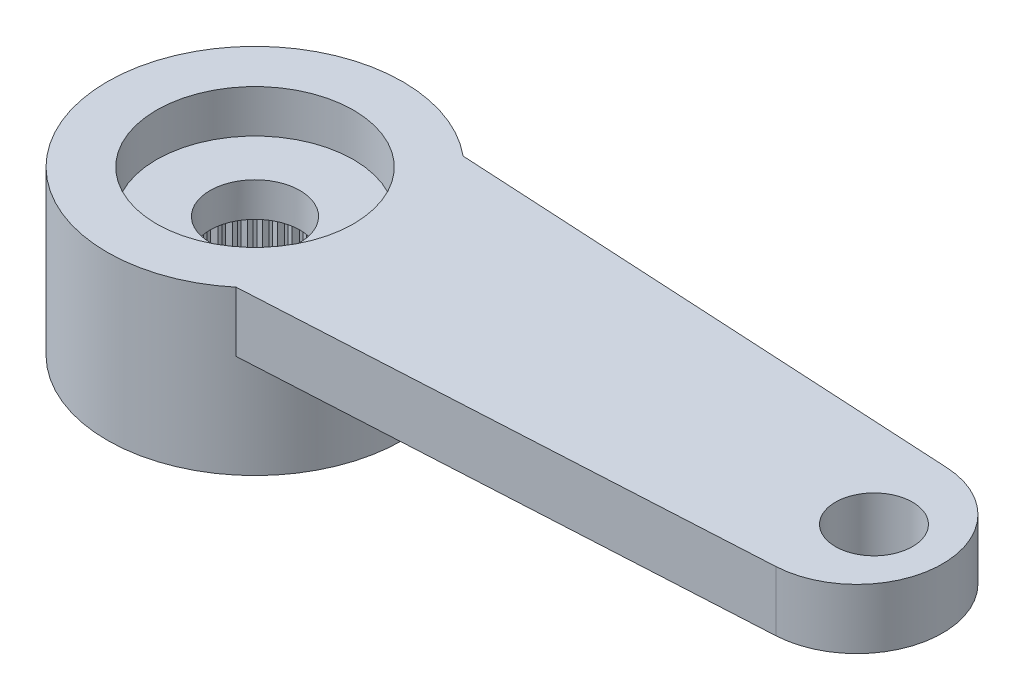
from build123d import *

# Parameters (mm, degrees)
BOSS_EXTRUDE1_DEPTH = 1.4
SKETCH2_R           = 3.45
BOSS_EXTRUDE2_DEPTH = 2.4
CUT_EXTRUDE1_DEPTH  = 2
HOLE1_D             = 2.1
HOLE1_DEPTH         = 3.8
HOLE1_CBORE_D       = 4.6
HOLE1_CBORE_DEPTH   = 1
CUT_EXTRUDE2_DEPTH  = 10
SKETCH7_R           = 0.9
CUT_EXTRUDE3_DEPTH  = 10


with BuildPart() as part:
    # Sketch1 → Boss-Extrude1 (new body)
    with BuildSketch(Plane(origin=(0, 0, 0), x_dir=(1, 0, 0), z_dir=(0, 1, 0))):
        with BuildLine():
            Line((2.209072, -2.65), (14.159122, -1.997021))
            ThreePointArc((14.159122, -1.997021), (16.05, 0), (14.159122, 1.997021))
            Line((14.159122, 1.997021), (2.209072, 2.65))
            ThreePointArc((2.209072, 2.65), (0, 3.45), (-2.209072, 2.65))
            Line((-2.209072, 2.65), (-14.159122, 1.997021))
            ThreePointArc((-14.159122, 1.997021), (-16.05, 0), (-14.159122, -1.997021))
            Line((-14.159122, -1.997021), (-2.209072, -2.65))
            ThreePointArc((-2.209072, -2.65), (0, -3.45), (2.209072, -2.65))
        make_face()
    extrude(amount=-BOSS_EXTRUDE1_DEPTH)

    # Sketch2 → Boss-Extrude2 (add)
    with BuildSketch(Plane.XZ.offset(1.4)):
        with Locations(Location((0, 0, 0), (0, 0, 129.814998))):
            Circle(SKETCH2_R)
    extrude(amount=BOSS_EXTRUDE2_DEPTH)

    # Sketch3 → Cut-Extrude1 (cut)
    with BuildSketch(Plane.XZ.offset(3.8)):
        with BuildLine():
            Line((-0.160985, 2.469759), (-0.248255, 2.36199))
            Line((-0.248255, 2.36199), (-0.356024, 2.449259))
            ThreePointArc((-0.356024, 2.449259), (-0.387175, 2.444529), (-0.418263, 2.439402))
            Line((-0.418263, 2.439402), (-0.49379, 2.323101))
            Line((-0.49379, 2.323101), (-0.610091, 2.398627))
            ThreePointArc((-0.610091, 2.398627), (-0.640577, 2.390666), (-0.670959, 2.382318))
            Line((-0.670959, 2.382318), (-0.733915, 2.258759))
            Line((-0.733915, 2.258759), (-0.857474, 2.321716))
            ThreePointArc((-0.857474, 2.321716), (-0.886961, 2.310612), (-0.916303, 2.299133))
            Line((-0.916303, 2.299133), (-0.966, 2.16967))
            Line((-0.966, 2.16967), (-1.095462, 2.219367))
            ThreePointArc((-1.095462, 2.219367), (-1.123626, 2.205241), (-1.151609, 2.190758))
            Line((-1.151609, 2.190758), (-1.1875, 2.05681))
            Line((-1.1875, 2.05681), (-1.321448, 2.092702))
            ThreePointArc((-1.321448, 2.092702), (-1.347982, 2.07571), (-1.374297, 2.058381))
            Line((-1.374297, 2.058381), (-1.39599, 1.921415))
            Line((-1.39599, 1.921415), (-1.532956, 1.943109))
            ThreePointArc((-1.532956, 1.943109), (-1.557568, 1.923436), (-1.581928, 1.903452))
            Line((-1.581928, 1.903452), (-1.589185, 1.764969))
            Line((-1.589185, 1.764969), (-1.727668, 1.772227))
            ThreePointArc((-1.727668, 1.772227), (-1.750089, 1.750089), (-1.772227, 1.727668))
            Line((-1.772227, 1.727668), (-1.764969, 1.589185))
            Line((-1.764969, 1.589185), (-1.903452, 1.581928))
            ThreePointArc((-1.903452, 1.581928), (-1.923436, 1.557568), (-1.943109, 1.532956))
            Line((-1.943109, 1.532956), (-1.921415, 1.39599))
            Line((-1.921415, 1.39599), (-2.058381, 1.374297))
            ThreePointArc((-2.058381, 1.374297), (-2.07571, 1.347982), (-2.092702, 1.321448))
            Line((-2.092702, 1.321448), (-2.05681, 1.1875))
            Line((-2.05681, 1.1875), (-2.190758, 1.151609))
            ThreePointArc((-2.190758, 1.151609), (-2.205241, 1.123626), (-2.219367, 1.095462))
            Line((-2.219367, 1.095462), (-2.16967, 0.966))
            Line((-2.16967, 0.966), (-2.299133, 0.916303))
            ThreePointArc((-2.299133, 0.916303), (-2.310612, 0.886961), (-2.321716, 0.857474))
            Line((-2.321716, 0.857474), (-2.258759, 0.733915))
            Line((-2.258759, 0.733915), (-2.382318, 0.670959))
            ThreePointArc((-2.382318, 0.670959), (-2.390666, 0.640577), (-2.398627, 0.610091))
            Line((-2.398627, 0.610091), (-2.323101, 0.49379))
            Line((-2.323101, 0.49379), (-2.439402, 0.418263))
            ThreePointArc((-2.439402, 0.418263), (-2.444529, 0.387175), (-2.449259, 0.356024))
            Line((-2.449259, 0.356024), (-2.36199, 0.248255))
            Line((-2.36199, 0.248255), (-2.469759, 0.160985))
            ThreePointArc((-2.469759, 0.160985), (-2.471608, 0.129531), (-2.473057, 0.098057))
            Line((-2.473057, 0.098057), (-2.375, 0))
            Line((-2.375, 0), (-2.473057, -0.098057))
            ThreePointArc((-2.473057, -0.098057), (-2.471608, -0.129531), (-2.469759, -0.160985))
            Line((-2.469759, -0.160985), (-2.36199, -0.248255))
            Line((-2.36199, -0.248255), (-2.449259, -0.356024))
            ThreePointArc((-2.449259, -0.356024), (-2.444529, -0.387175), (-2.439402, -0.418263))
            Line((-2.439402, -0.418263), (-2.323101, -0.49379))
            Line((-2.323101, -0.49379), (-2.398627, -0.610091))
            ThreePointArc((-2.398627, -0.610091), (-2.390666, -0.640577), (-2.382318, -0.670959))
            Line((-2.382318, -0.670959), (-2.258759, -0.733915))
            Line((-2.258759, -0.733915), (-2.321716, -0.857474))
            ThreePointArc((-2.321716, -0.857474), (-2.310612, -0.886961), (-2.299133, -0.916303))
            Line((-2.299133, -0.916303), (-2.16967, -0.966))
            Line((-2.16967, -0.966), (-2.219367, -1.095462))
            ThreePointArc((-2.219367, -1.095462), (-2.205241, -1.123626), (-2.190758, -1.151609))
            Line((-2.190758, -1.151609), (-2.05681, -1.1875))
            Line((-2.05681, -1.1875), (-2.092702, -1.321448))
            ThreePointArc((-2.092702, -1.321448), (-2.07571, -1.347982), (-2.058381, -1.374297))
            Line((-2.058381, -1.374297), (-1.921415, -1.39599))
            Line((-1.921415, -1.39599), (-1.943109, -1.532956))
            ThreePointArc((-1.943109, -1.532956), (-1.923436, -1.557568), (-1.903452, -1.581928))
            Line((-1.903452, -1.581928), (-1.764969, -1.589185))
            Line((-1.764969, -1.589185), (-1.772227, -1.727668))
            ThreePointArc((-1.772227, -1.727668), (-1.750089, -1.750089), (-1.727668, -1.772227))
            Line((-1.727668, -1.772227), (-1.589185, -1.764969))
            Line((-1.589185, -1.764969), (-1.581928, -1.903452))
            ThreePointArc((-1.581928, -1.903452), (-1.557568, -1.923436), (-1.532956, -1.943109))
            Line((-1.532956, -1.943109), (-1.39599, -1.921415))
            Line((-1.39599, -1.921415), (-1.374297, -2.058381))
            ThreePointArc((-1.374297, -2.058381), (-1.347982, -2.07571), (-1.321448, -2.092702))
            Line((-1.321448, -2.092702), (-1.1875, -2.05681))
            Line((-1.1875, -2.05681), (-1.151609, -2.190758))
            ThreePointArc((-1.151609, -2.190758), (-1.123626, -2.205241), (-1.095462, -2.219367))
            Line((-1.095462, -2.219367), (-0.966, -2.16967))
            Line((-0.966, -2.16967), (-0.916303, -2.299133))
            ThreePointArc((-0.916303, -2.299133), (-0.886961, -2.310612), (-0.857474, -2.321716))
            Line((-0.857474, -2.321716), (-0.733915, -2.258759))
            Line((-0.733915, -2.258759), (-0.670959, -2.382318))
            ThreePointArc((-0.670959, -2.382318), (-0.640577, -2.390666), (-0.610091, -2.398627))
            Line((-0.610091, -2.398627), (-0.49379, -2.323101))
            Line((-0.49379, -2.323101), (-0.418263, -2.439402))
            ThreePointArc((-0.418263, -2.439402), (-0.387175, -2.444529), (-0.356024, -2.449259))
            Line((-0.356024, -2.449259), (-0.248255, -2.36199))
            Line((-0.248255, -2.36199), (-0.160985, -2.469759))
            ThreePointArc((-0.160985, -2.469759), (-0.129531, -2.471608), (-0.098057, -2.473057))
            Line((-0.098057, -2.473057), (0, -2.375))
            Line((0, -2.375), (0.098057, -2.473057))
            ThreePointArc((0.098057, -2.473057), (0.129531, -2.471608), (0.160985, -2.469759))
            Line((0.160985, -2.469759), (0.248255, -2.36199))
            Line((0.248255, -2.36199), (0.356024, -2.449259))
            ThreePointArc((0.356024, -2.449259), (0.387175, -2.444529), (0.418263, -2.439402))
            Line((0.418263, -2.439402), (0.49379, -2.323101))
            Line((0.49379, -2.323101), (0.610091, -2.398627))
            ThreePointArc((0.610091, -2.398627), (0.640577, -2.390666), (0.670959, -2.382318))
            Line((0.670959, -2.382318), (0.733915, -2.258759))
            Line((0.733915, -2.258759), (0.857474, -2.321716))
            ThreePointArc((0.857474, -2.321716), (0.886961, -2.310612), (0.916303, -2.299133))
            Line((0.916303, -2.299133), (0.966, -2.16967))
            Line((0.966, -2.16967), (1.095462, -2.219367))
            ThreePointArc((1.095462, -2.219367), (1.123626, -2.205241), (1.151609, -2.190758))
            Line((1.151609, -2.190758), (1.1875, -2.05681))
            Line((1.1875, -2.05681), (1.321448, -2.092702))
            ThreePointArc((1.321448, -2.092702), (1.347982, -2.07571), (1.374297, -2.058381))
            Line((1.374297, -2.058381), (1.39599, -1.921415))
            Line((1.39599, -1.921415), (1.532956, -1.943109))
            ThreePointArc((1.532956, -1.943109), (1.557568, -1.923436), (1.581928, -1.903452))
            Line((1.581928, -1.903452), (1.589185, -1.764969))
            Line((1.589185, -1.764969), (1.727668, -1.772227))
            ThreePointArc((1.727668, -1.772227), (1.750089, -1.750089), (1.772227, -1.727668))
            Line((1.772227, -1.727668), (1.764969, -1.589185))
            Line((1.764969, -1.589185), (1.903452, -1.581928))
            ThreePointArc((1.903452, -1.581928), (1.923436, -1.557568), (1.943109, -1.532956))
            Line((1.943109, -1.532956), (1.921415, -1.39599))
            Line((1.921415, -1.39599), (2.058381, -1.374297))
            ThreePointArc((2.058381, -1.374297), (2.07571, -1.347982), (2.092702, -1.321448))
            Line((2.092702, -1.321448), (2.05681, -1.1875))
            Line((2.05681, -1.1875), (2.190758, -1.151609))
            ThreePointArc((2.190758, -1.151609), (2.205241, -1.123626), (2.219367, -1.095462))
            Line((2.219367, -1.095462), (2.16967, -0.966))
            Line((2.16967, -0.966), (2.299133, -0.916303))
            ThreePointArc((2.299133, -0.916303), (2.310612, -0.886961), (2.321716, -0.857474))
            Line((2.321716, -0.857474), (2.258759, -0.733915))
            Line((2.258759, -0.733915), (2.382318, -0.670959))
            ThreePointArc((2.382318, -0.670959), (2.390666, -0.640577), (2.398627, -0.610091))
            Line((2.398627, -0.610091), (2.323101, -0.49379))
            Line((2.323101, -0.49379), (2.439402, -0.418263))
            ThreePointArc((2.439402, -0.418263), (2.444529, -0.387175), (2.449259, -0.356024))
            Line((2.449259, -0.356024), (2.36199, -0.248255))
            Line((2.36199, -0.248255), (2.469759, -0.160985))
            ThreePointArc((2.469759, -0.160985), (2.471608, -0.129531), (2.473057, -0.098057))
            Line((2.473057, -0.098057), (2.375, 0))
            Line((2.375, 0), (2.473057, 0.098057))
            ThreePointArc((2.473057, 0.098057), (2.471608, 0.129531), (2.469759, 0.160985))
            Line((2.469759, 0.160985), (2.36199, 0.248255))
            Line((2.36199, 0.248255), (2.449259, 0.356024))
            ThreePointArc((2.449259, 0.356024), (2.444529, 0.387175), (2.439402, 0.418263))
            Line((2.439402, 0.418263), (2.323101, 0.49379))
            Line((2.323101, 0.49379), (2.398627, 0.610091))
            ThreePointArc((2.398627, 0.610091), (2.390666, 0.640577), (2.382318, 0.670959))
            Line((2.382318, 0.670959), (2.258759, 0.733915))
            Line((2.258759, 0.733915), (2.321716, 0.857474))
            ThreePointArc((2.321716, 0.857474), (2.310612, 0.886961), (2.299133, 0.916303))
            Line((2.299133, 0.916303), (2.16967, 0.966))
            Line((2.16967, 0.966), (2.219367, 1.095462))
            ThreePointArc((2.219367, 1.095462), (2.205241, 1.123626), (2.190758, 1.151609))
            Line((2.190758, 1.151609), (2.05681, 1.1875))
            Line((2.05681, 1.1875), (2.092702, 1.321448))
            ThreePointArc((2.092702, 1.321448), (2.07571, 1.347982), (2.058381, 1.374297))
            Line((2.058381, 1.374297), (1.921415, 1.39599))
            Line((1.921415, 1.39599), (1.943109, 1.532956))
            ThreePointArc((1.943109, 1.532956), (1.923436, 1.557568), (1.903452, 1.581928))
            Line((1.903452, 1.581928), (1.764969, 1.589185))
            Line((1.764969, 1.589185), (1.772227, 1.727668))
            ThreePointArc((1.772227, 1.727668), (1.750089, 1.750089), (1.727668, 1.772227))
            Line((1.727668, 1.772227), (1.589185, 1.764969))
            Line((1.589185, 1.764969), (1.581928, 1.903452))
            ThreePointArc((1.581928, 1.903452), (1.557568, 1.923436), (1.532956, 1.943109))
            Line((1.532956, 1.943109), (1.39599, 1.921415))
            Line((1.39599, 1.921415), (1.374297, 2.058381))
            ThreePointArc((1.374297, 2.058381), (1.347982, 2.07571), (1.321448, 2.092702))
            Line((1.321448, 2.092702), (1.1875, 2.05681))
            Line((1.1875, 2.05681), (1.151609, 2.190758))
            ThreePointArc((1.151609, 2.190758), (1.123626, 2.205241), (1.095462, 2.219367))
            Line((1.095462, 2.219367), (0.966, 2.16967))
            Line((0.966, 2.16967), (0.916303, 2.299133))
            ThreePointArc((0.916303, 2.299133), (0.886961, 2.310612), (0.857474, 2.321716))
            Line((0.857474, 2.321716), (0.733915, 2.258759))
            Line((0.733915, 2.258759), (0.670959, 2.382318))
            ThreePointArc((0.670959, 2.382318), (0.640577, 2.390666), (0.610091, 2.398627))
            Line((0.610091, 2.398627), (0.49379, 2.323101))
            Line((0.49379, 2.323101), (0.418263, 2.439402))
            ThreePointArc((0.418263, 2.439402), (0.387175, 2.444529), (0.356024, 2.449259))
            Line((0.356024, 2.449259), (0.248255, 2.36199))
            Line((0.248255, 2.36199), (0.160985, 2.469759))
            ThreePointArc((0.160985, 2.469759), (0.129531, 2.471608), (0.098057, 2.473057))
            Line((0.098057, 2.473057), (0, 2.375))
            Line((0, 2.375), (-0.098057, 2.473057))
            ThreePointArc((-0.098057, 2.473057), (-0.129531, 2.471608), (-0.160985, 2.469759))
        make_face()
    extrude(amount=-CUT_EXTRUDE1_DEPTH, mode=Mode.SUBTRACT)

    # Hole1
    with Locations(Plane(origin=(0, 0, 0), x_dir=(1, 0, 0), z_dir=(0, 1, 0))):
        with Locations((0, 0)):
            CounterBoreHole(HOLE1_D / 2, HOLE1_CBORE_D / 2, HOLE1_CBORE_DEPTH, depth=HOLE1_DEPTH)

    # Sketch6 → Cut-Extrude2 (cut)
    with BuildSketch(Plane(origin=(0, 0, 0), x_dir=(1, 0, 0), z_dir=(0, 1, 0))):
        with BuildLine():
            Line((-14.159122, -1.997021), (-2.209072, -2.65))
            ThreePointArc((-2.209072, -2.65), (-3.45, 0), (-2.209072, 2.65))
            Line((-2.209072, 2.65), (-2.123962, 2.765152))
            Line((-2.123962, 2.765152), (-14.05, 2.65))
            Line((-14.05, 2.65), (-16.05, 2.65))
            Line((-16.05, 2.65), (-16.05, 0))
            ThreePointArc((-16.05, 0), (-15.502282, -1.375092), (-14.159122, -1.997021))
        make_face()
    extrude(amount=-CUT_EXTRUDE2_DEPTH, mode=Mode.SUBTRACT)

    # Sketch7 → Cut-Extrude3 (cut)
    with BuildSketch(Plane(origin=(0, 0, 0), x_dir=(1, 0, 0), z_dir=(0, 1, 0))):
        with Locations(Location((14.45, 0, 0), (0, 0, 270))):
            Circle(SKETCH7_R)
    extrude(amount=-CUT_EXTRUDE3_DEPTH, mode=Mode.SUBTRACT)


solid = part.part
